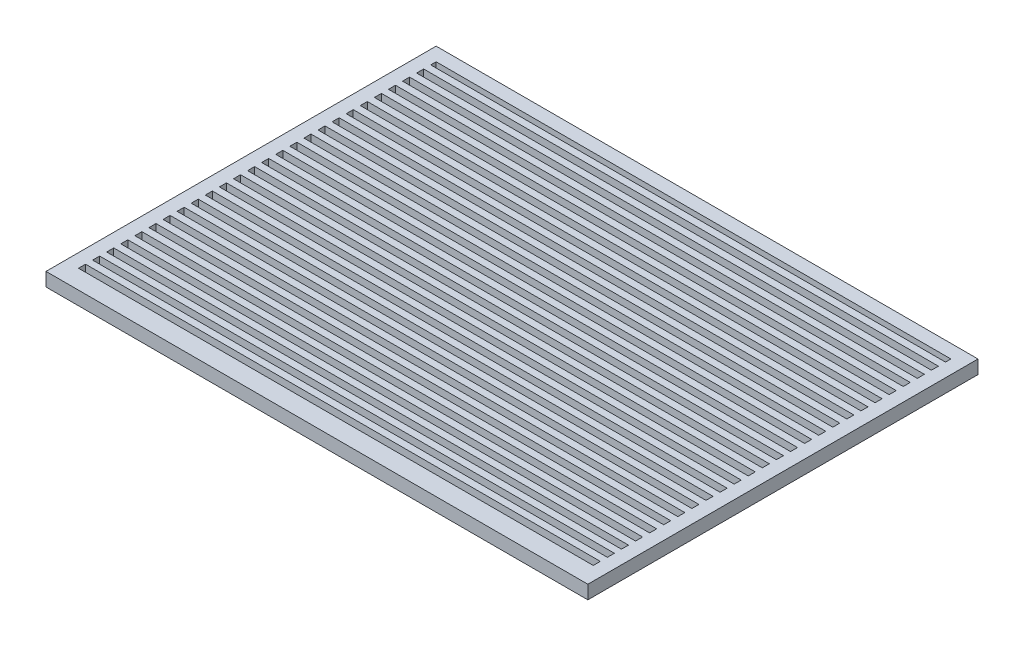
from build123d import *

# Parameters (mm, degrees)
SKETCH1_W           = 200
SKETCH1_H           = 144
BOSS_EXTRUDE1_DEPTH = 5
SKETCH2_W           = 190
SKETCH2_H           = 2
SKETCH2_H_2         = 2.6
CUT_EXTRUDE1_DEPTH  = 5


with BuildPart() as part:
    # Sketch1 → Boss-Extrude1 (new body)
    with BuildSketch(Plane(origin=(0, 0, 0), x_dir=(1, 0, 0), z_dir=(0, 1, 0))):
        with Locations((100, 72)):
            Rectangle(SKETCH1_W, SKETCH1_H)
    extrude(amount=BOSS_EXTRUDE1_DEPTH)

    # Sketch2 → Cut-Extrude1 (cut)
    with BuildSketch(Plane(origin=(0, 5, 0), x_dir=(1, 0, 0), z_dir=(0, 1, 0))):
        with Locations((100, 138)):
            Rectangle(SKETCH2_W, SKETCH2_H)
        with Locations((100, 133.1)):
            Rectangle(SKETCH2_W, SKETCH2_H_2)
        with Locations((100, 127.9)):
            Rectangle(SKETCH2_W, SKETCH2_H_2)
        with Locations((100, 122.7)):
            Rectangle(SKETCH2_W, SKETCH2_H_2)
        with Locations((100, 117.5)):
            Rectangle(SKETCH2_W, SKETCH2_H_2)
        with Locations((100, 112.3)):
            Rectangle(SKETCH2_W, SKETCH2_H_2)
        with Locations((100, 107.1)):
            Rectangle(SKETCH2_W, SKETCH2_H_2)
        with Locations((100, 101.9)):
            Rectangle(SKETCH2_W, SKETCH2_H_2)
        with Locations((100, 96.7)):
            Rectangle(SKETCH2_W, SKETCH2_H_2)
        with Locations((100, 91.5)):
            Rectangle(SKETCH2_W, SKETCH2_H_2)
        with Locations((100, 86.3)):
            Rectangle(SKETCH2_W, SKETCH2_H_2)
        with Locations((100, 81.1)):
            Rectangle(SKETCH2_W, SKETCH2_H_2)
        with Locations((100, 75.9)):
            Rectangle(SKETCH2_W, SKETCH2_H_2)
        Polygon((195, 72), (5, 72), (5, 70.934071529), (5, 69.4), (195, 69.4), align=None)
        with Locations((100, 65.5)):
            Rectangle(SKETCH2_W, SKETCH2_H_2)
        with Locations((100, 60.3)):
            Rectangle(SKETCH2_W, SKETCH2_H_2)
        with Locations((100, 55.1)):
            Rectangle(SKETCH2_W, SKETCH2_H_2)
        with Locations((100, 49.9)):
            Rectangle(SKETCH2_W, SKETCH2_H_2)
        Polygon((195, 45.599396022), (195, 46), (5, 46), (5, 45.599396022), (5, 43.4), (195, 43.4), align=None)
        with Locations((100, 39.5)):
            Rectangle(SKETCH2_W, SKETCH2_H_2)
        with Locations((100, 34.3)):
            Rectangle(SKETCH2_W, SKETCH2_H_2)
        with Locations((100, 29.1)):
            Rectangle(SKETCH2_W, SKETCH2_H_2)
        with Locations((100, 23.9)):
            Rectangle(SKETCH2_W, SKETCH2_H_2)
        Polygon((195, 18.455100837), (195, 20), (5, 20), (5, 17.4), (195, 17.4), align=None)
        with Locations((100, 13.5)):
            Rectangle(SKETCH2_W, SKETCH2_H_2)
        with Locations((100, 8.3)):
            Rectangle(SKETCH2_W, SKETCH2_H_2)
    extrude(amount=-CUT_EXTRUDE1_DEPTH, mode=Mode.SUBTRACT)


solid = part.part
